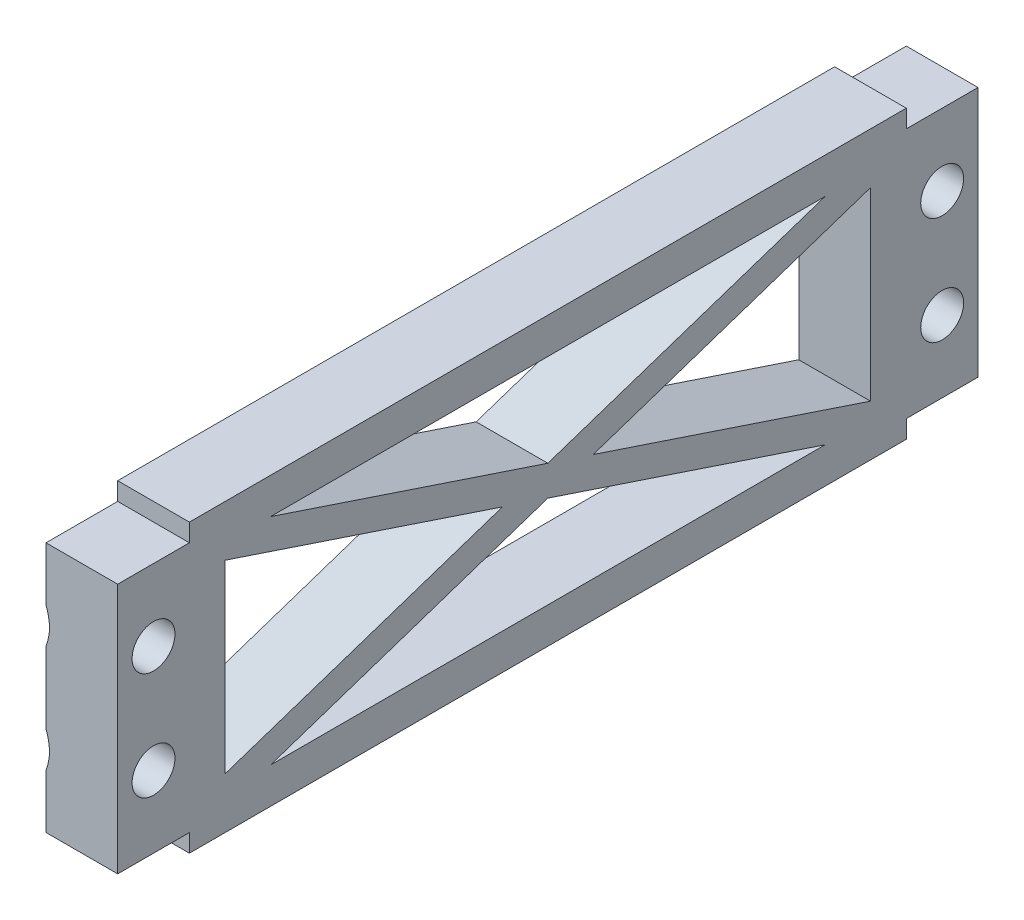
from build123d import *

# Parameters (mm, degrees)
BOSS_EXTRUDE1_DEPTH                               = 6.35
CSK_FOR_6_FLAT_HEAD_MACHINE_SCREW_100_D           = 3.7973
CSK_FOR_6_FLAT_HEAD_MACHINE_SCREW_100_CSINK_D     = 7.0866
CSK_FOR_6_FLAT_HEAD_MACHINE_SCREW_100_CSINK_ANGLE = 100
CUT_EXTRUDE1_DEPTH                                = 81.572467382


with BuildPart() as part:
    # Sketch1 → Boss-Extrude1 (new body)
    with BuildSketch(Plane(origin=(0, 0, 0), x_dir=(0, 0, -1), z_dir=(1, 0, 0))):
        Polygon((69.85, 25.4), (38.1, 25.4), (38.1, 0), (69.85, 0), (69.85, 1.5875), (76.2, 1.5875), (76.2, 23.8125), (69.85, 23.8125), align=None)
        Polygon((38.1, 0), (38.1, 25.4), (6.35, 25.4), (6.35, 23.8125), (0, 23.8125), (0, 1.5875), (6.35, 1.5875), (6.35, 0), align=None)
    extrude(amount=BOSS_EXTRUDE1_DEPTH)

    # CSK for #6 Flat Head Machine Screw (100)1 (through all)
    with Locations(Plane.ZY):
        with Locations((-73.025, 17.4625), (-73.025, 7.9375), (-3.175, 17.4625), (-3.175, 7.9375)):
            CounterSinkHole(CSK_FOR_6_FLAT_HEAD_MACHINE_SCREW_100_D / 2, CSK_FOR_6_FLAT_HEAD_MACHINE_SCREW_100_CSINK_D / 2, counter_sink_angle=CSK_FOR_6_FLAT_HEAD_MACHINE_SCREW_100_CSINK_ANGLE)

    # Sketch4 → Cut-Extrude1 (cut, through all)
    with BuildSketch(Plane.ZY):
        Polygon((-42.116092628, 12.7), (-66.675, 20.886302457), (-66.675, 4.513697543), align=None)
        Polygon((-13.541092628, 22.225), (-62.658907372, 22.225), (-38.1, 14.038697543), align=None)
        Polygon((-9.525, 20.886302457), (-34.083907372, 12.7), (-9.525, 4.513697543), align=None)
        Polygon((-13.541092628, 3.175), (-38.1, 11.361302457), (-62.658907372, 3.175), align=None)
    extrude(amount=-CUT_EXTRUDE1_DEPTH, mode=Mode.SUBTRACT)


solid = part.part
